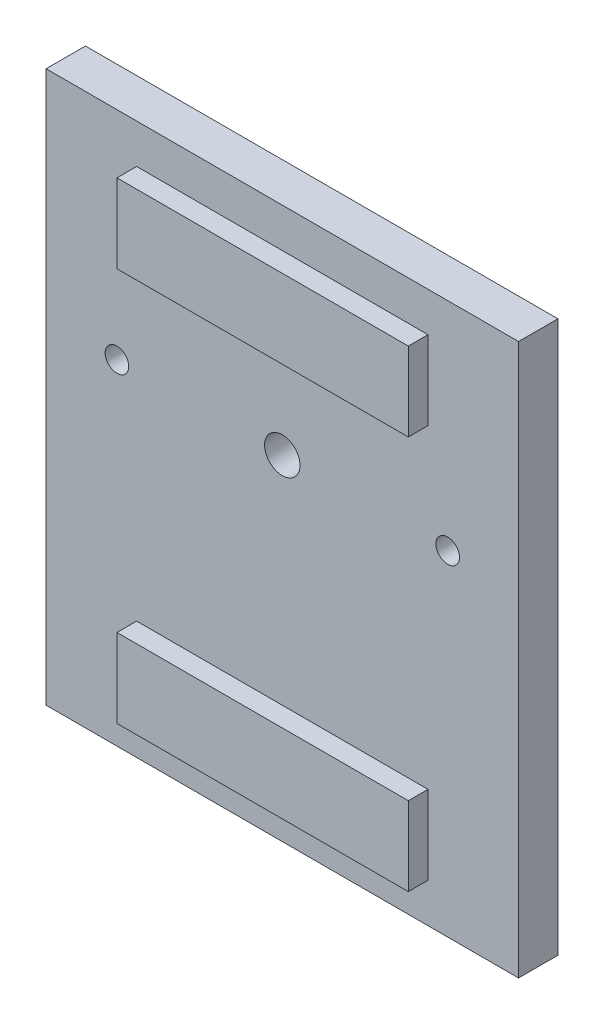
from build123d import *

# Parameters (mm, degrees)
SKETCH1_W           = 120
SKETCH1_H           = 140
BOSS_EXTRUDE1_DEPTH = 10
SKETCH2_W           = 74
SKETCH2_H           = 20
BOSS_EXTRUDE2_DEPTH = 5
SKETCH4_R           = 3
SKETCH4_R_2         = 4.5
CUT_EXTRUDE1_DEPTH  = 15


with BuildPart() as part:
    # Sketch1 → Boss-Extrude1 (new body)
    with BuildSketch(Plane.XY):
        with Locations((-60, -70)):
            Rectangle(SKETCH1_W, SKETCH1_H)
    extrude(amount=BOSS_EXTRUDE1_DEPTH)

    # Sketch2 → Boss-Extrude2 (add)
    with BuildSketch(Plane.XY.offset(10)):
        with Locations((-60, -20)):
            Rectangle(SKETCH2_W, SKETCH2_H)
        with Locations((-60, -120)):
            Rectangle(SKETCH2_W, SKETCH2_H)
    extrude(amount=BOSS_EXTRUDE2_DEPTH)

    # Sketch4 → Cut-Extrude1 (cut)
    with BuildSketch(Plane.XY.offset(15)):
        with Locations((-102, -55)):
            Circle(SKETCH4_R)
        with Locations((-60, -55)):
            Circle(SKETCH4_R_2)
        with Locations((-18, -55)):
            Circle(SKETCH4_R)
    extrude(amount=-CUT_EXTRUDE1_DEPTH, mode=Mode.SUBTRACT)


solid = part.part
